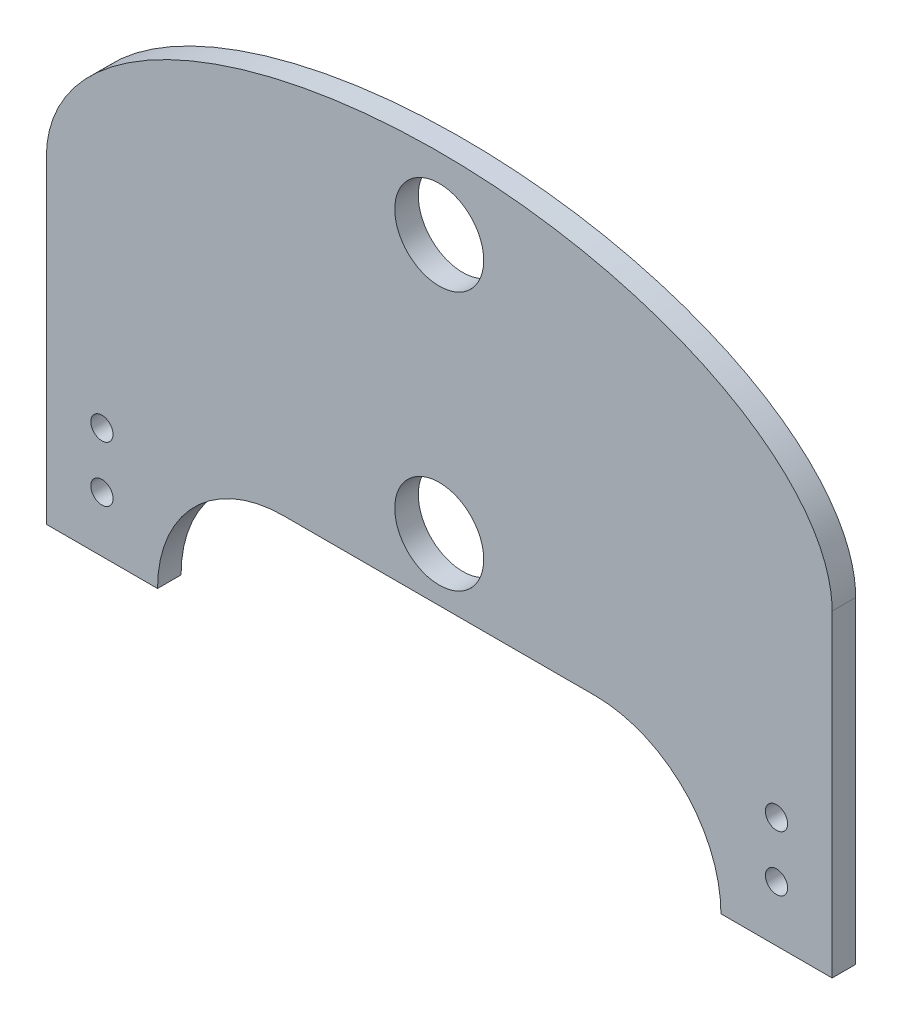
from build123d import *

# Parameters (mm, degrees)
SKETCH1_R           = 6
BOSS_EXTRUDE1_DEPTH = 3.175
SKETCH4_R           = 1.5
CUT_EXTRUDE2_DEPTH  = 128.067228761
CUT_EXTRUDE4_DEPTH  = 128.067228761


with BuildPart() as part:
    # Sketch1 → Boss-Extrude1 (new body)
    with BuildSketch(Plane.XY):
        with BuildLine():
            ThreePointArc((15, 0), (19.97918472, 12.02081528), (32, 17))
            Line((32, 17), (53, 17))
            Line((53, 17), (74, 17))
            ThreePointArc((74, 17), (86.02081528, 12.02081528), (91, 0))
            Line((91, 0), (106, 0))
            Line((106, 0), (106, 70))
            Line((106, 70), (0, 70))
            Line((0, 70), (0, 0))
            Line((0, 0), (15, 0))
        make_face()
        with Locations((53, 25.4)):
            Circle(SKETCH1_R, mode=Mode.SUBTRACT)
        with Locations((53, 60.325)):
            Circle(SKETCH1_R, mode=Mode.SUBTRACT)
    extrude(amount=BOSS_EXTRUDE1_DEPTH)

    # Sketch4 → Cut-Extrude2 (cut, through all)
    with BuildSketch(Plane(origin=(0, 0, 0), x_dir=(-1, 0, 0), z_dir=(0, 0, -1))):
        with Locations((-7.5, 15)):
            Circle(SKETCH4_R)
        with Locations((-7.5, 7.5)):
            Circle(SKETCH4_R)
        with Locations((-98.5, 7.5)):
            Circle(SKETCH4_R)
        with Locations((-98.5, 15)):
            Circle(SKETCH4_R)
    extrude(amount=-CUT_EXTRUDE2_DEPTH, mode=Mode.SUBTRACT)

    # Sketch6 → Cut-Extrude4 (cut, through all)
    with BuildSketch(Plane(origin=(0, 0, 0), x_dir=(-1, 0, 0), z_dir=(0, 0, -1))):
        with BuildLine():
            add(Edge.make_bspline(
                [(-53, 70), (-106, 70), (-106, 42.8625)],
                knots=[1.570796327, 1.570796327, 1.570796327, 3.141592654, 3.141592654, 3.141592654], degree=2, weights=[1, 0.707106781, 1]))
            Line((-53, 70), (-106, 70))
            Line((-106, 70), (-106, 42.8625))
        make_face()
        with BuildLine():
            add(Edge.make_bspline(
                [(0, 42.8625), (0, 70), (-53, 70)],
                knots=[0, 0, 0, 1.570796327, 1.570796327, 1.570796327], degree=2, weights=[1, 0.707106781, 1]))
            Line((0, 42.8625), (0, 70))
            Line((0, 70), (-53, 70))
        make_face()
    extrude(amount=-CUT_EXTRUDE4_DEPTH, mode=Mode.SUBTRACT)


solid = part.part
